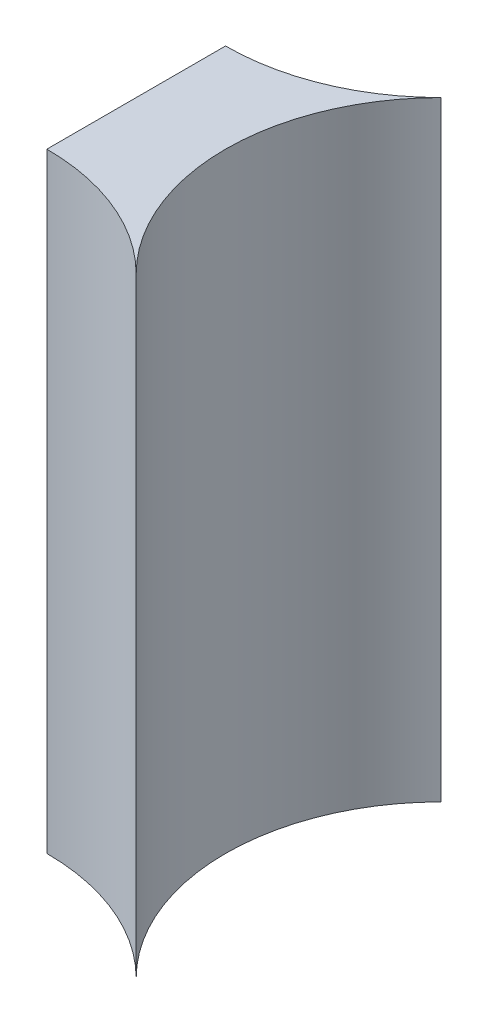
from build123d import *

# Parameters (mm, degrees)
BOSS_EXTRUDE1_DEPTH = 10


with BuildPart() as part:
    # Sketch1 → Boss-Extrude1 (new body)
    with BuildSketch(Plane(origin=(0, 0, 0), x_dir=(1, 0, 0), z_dir=(0, 1, 0))):
        with BuildLine():
            Line((0, 1.464466094), (0, -1.464466094))
            ThreePointArc((0, -1.464466094), (1.35299025, -1.733592588), (2.5, -2.5))
            ThreePointArc((2.5, -2.5), (1.464466094, 0), (2.5, 2.5))
            ThreePointArc((2.5, 2.5), (1.35299025, 1.733592588), (0, 1.464466094))
        make_face()
    extrude(amount=BOSS_EXTRUDE1_DEPTH)


solid = part.part
